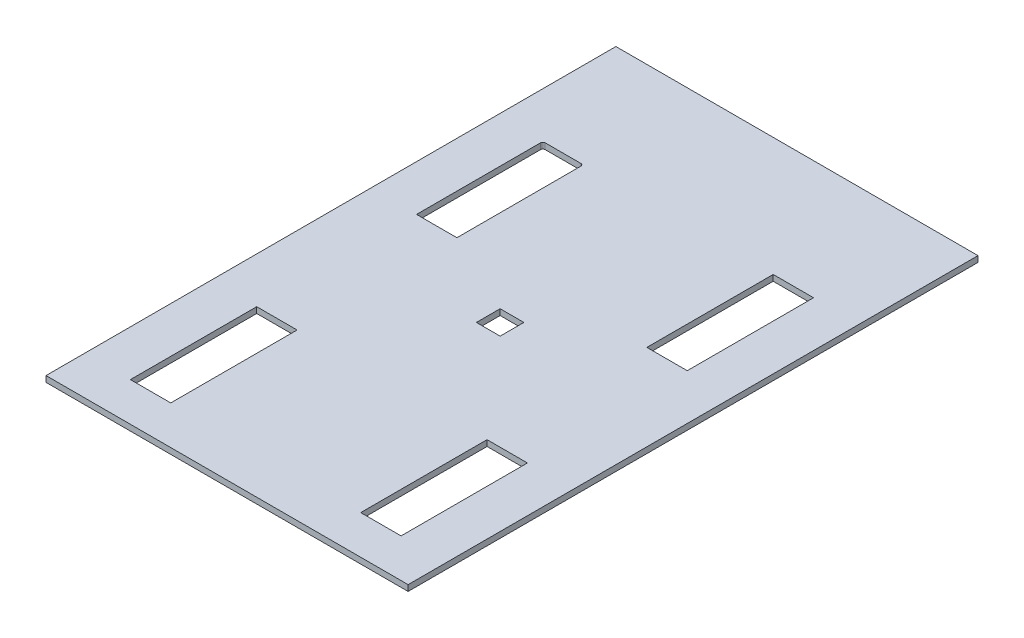
from build123d import *

# Parameters (mm, degrees)
SKETCH1_W           = 387.35
SKETCH1_H           = 609.6
BOSS_EXTRUDE1_DEPTH = 6.35
SKETCH2_W           = 43.18
SKETCH2_H           = 135.128
CUT_EXTRUDE1_DEPTH  = 362.183288823
SKETCH4_W           = 25.4
SKETCH4_H           = 25.4
CUT_EXTRUDE3_DEPTH  = 362.183288823
FILLET1_R           = 2.54


with BuildPart() as part:
    # Sketch1 → Boss-Extrude1 (new body)
    with BuildSketch(Plane(origin=(0, 0, 0), x_dir=(1, 0, 0), z_dir=(0, 1, 0))):
        Rectangle(SKETCH1_W, SKETCH1_H)
    extrude(amount=BOSS_EXTRUDE1_DEPTH)

    # Sketch2 → Cut-Extrude1 (cut, through all)
    with BuildSketch(Plane(origin=(0, 6.35, 0), x_dir=(1, 0, 0), z_dir=(0, 1, 0))):
        with Locations((123.19, -195.8594)):
            Rectangle(SKETCH2_W, SKETCH2_H)
        with Locations((123.19, 110.236)):
            Rectangle(SKETCH2_W, SKETCH2_H)
        with Locations((-123.19, -195.8594)):
            Rectangle(SKETCH2_W, SKETCH2_H)
        with Locations((-123.19, 110.236)):
            Rectangle(SKETCH2_W, SKETCH2_H)
    extrude(amount=-CUT_EXTRUDE1_DEPTH, mode=Mode.SUBTRACT)

    # Sketch4 → Cut-Extrude3 (cut, through all)
    with BuildSketch(Plane(origin=(0, 0, 0), x_dir=(1, 0, 0), z_dir=(0, 1, 0))):
        with Locations((0, -12.7)):
            Rectangle(SKETCH4_W, SKETCH4_H)
    extrude(amount=CUT_EXTRUDE3_DEPTH, mode=Mode.SUBTRACT)

    # Fillet1
    fillet1_edges = [part.edges().sort_by_distance(p)[0] for p in [
        (-144.78, 3.175, -177.8),
        (-101.6, 3.175, -177.8),
    ]]
    fillet(fillet1_edges, radius=FILLET1_R)


solid = part.part
